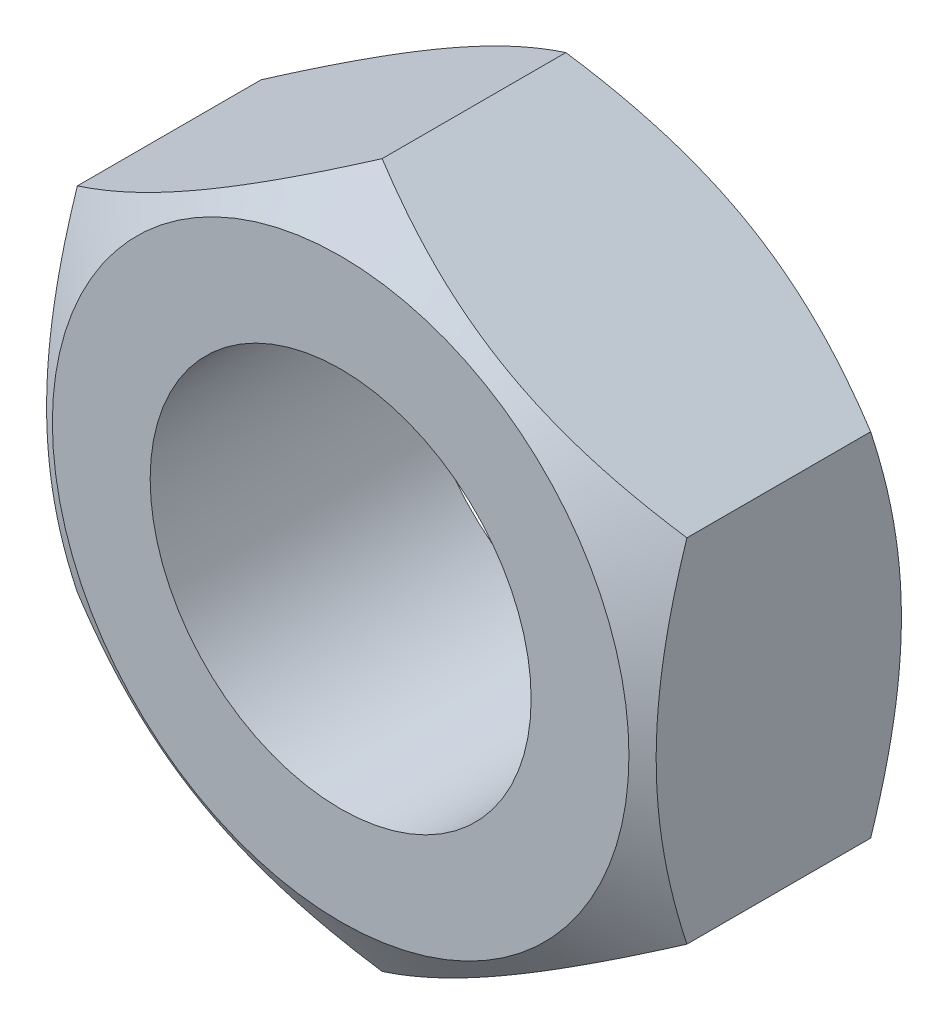
from build123d import *

# Parameters (mm, degrees)
SKETCH_1_R      = 2
EXTRUDE_1_DEPTH = 2.8


with BuildPart() as part:
    # 草图1 → 凸台-拉伸1 (new body)
    with BuildSketch(Plane.XY):
        Polygon((0, 3.695041723), (-3.2, 1.847520861), (-3.2, -1.847520861), (0, -3.695041723), (3.2, -1.847520861), (3.2, 1.847520861), align=None)
        Circle(SKETCH_1_R, mode=Mode.SUBTRACT)
    extrude(amount=EXTRUDE_1_DEPTH)

    # 草图2 → 切除-旋转1 (revolve, cut)
    with BuildSketch(Plane(origin=(0, 0, 0), x_dir=(0, 0, -1), z_dir=(1, 0, 0)), mode=Mode.PRIVATE) as cut_revolve_1_sk:
        Polygon((-2.364617701, 3.695041723), (-2.8, 3.026797752), (-2.8, 3.695041723), align=None)
    cut_revolve_1 = revolve(cut_revolve_1_sk.sketch.rotate(Axis((0, 0, 2.8), (0, 0, -1)), 300.000000046), axis=Axis((0, 0, 2.8), (0, 0, -1)), mode=Mode.SUBTRACT)

    # 镜向1: 切除-旋转1 across plane
    add(cut_revolve_1.mirror(Plane(origin=(0, 0, 1.4), x_dir=(1, 0, 0), z_dir=(0, 0, -1))), mode=Mode.SUBTRACT)


solid = part.part
